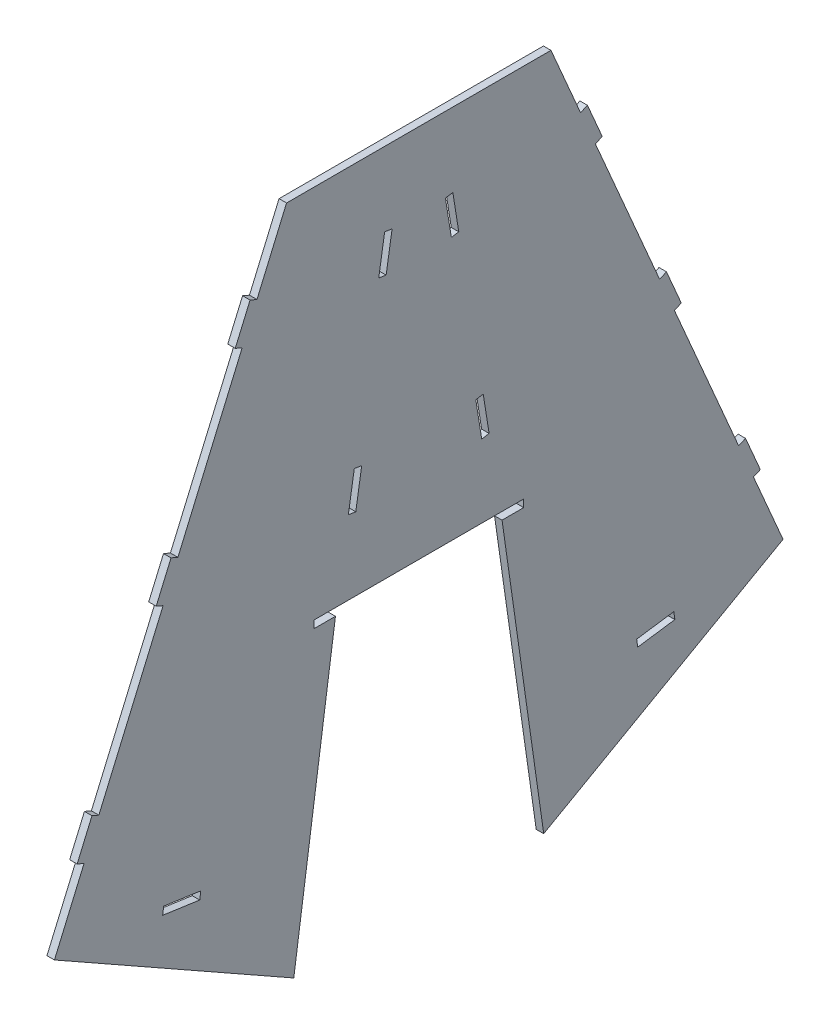
from build123d import *

# Parameters (mm, degrees)
BOSS_EXTRUDE1_DEPTH = 3


with BuildPart() as part:
    # Sketch2 → Boss-Extrude1 (new body)
    with BuildSketch(Plane(origin=(0, 0, 0), x_dir=(0, 0, -1), z_dir=(1, 0, 0))):
        Polygon((0, 0), (-95.762049044, 54.126056228), (-83.922091974, 81.649962502), (-86.677929554, 82.835440985), (-80.750537142, 96.614628885), (-77.994699562, 95.429150402), (-52.294504689, 155.173434164), (-55.050342269, 156.358912646), (-49.122949857, 170.138100547), (-46.367112277, 168.952622064), (-20.666917403, 228.696905826), (-23.422754983, 229.882384308), (-17.495362571, 243.661572208), (-14.739524991, 242.476093726), (-2.899567921, 270), (102.899567921, 270), (114.739524991, 242.476093726), (117.495362571, 243.661572208), (123.422754983, 229.882384308), (120.666917403, 228.696905826), (146.367112277, 168.952622064), (149.122949857, 170.138100547), (155.050342269, 156.358912646), (152.294504689, 155.173434164), (177.994699562, 95.429150402), (180.750537142, 96.614628885), (186.677929554, 82.835440985), (183.922091974, 81.649962502), (195.762049044, 54.126056228), (100, 0), (83.327078723, 117), (92, 117), (92, 120), (80, 120), (20, 120), (8, 120), (8, 117), (16.672921277, 117), align=None)
        Polygon((24.210004629, 164.434828436), (21.840147112, 149.623218958), (24.802469008, 149.149247454), (27.172326524, 163.960856933), align=None, mode=Mode.SUBTRACT)
        Polygon((36.360717046, 240.376781042), (33.990859529, 225.565171564), (36.953181425, 225.09120006), (39.323038941, 239.902809539), align=None, mode=Mode.SUBTRACT)
        Polygon((75.197530992, 149.149247454), (72.827673476, 163.960856933), (75.789995371, 164.434828436), (78.159852888, 149.623218958), align=None, mode=Mode.SUBTRACT)
        Polygon((63.046818575, 225.09120006), (66.009140471, 225.565171564), (63.639282954, 240.376781042), (60.676961059, 239.902809539), align=None, mode=Mode.SUBTRACT)
        Polygon((-52.479172452, 47.958090467), (-37.629195925, 45.841915342), (-37.2059609, 48.811910647), (-52.055937427, 50.928085772), align=None, mode=Mode.SUBTRACT)
        Polygon((137.2059609, 48.811910647), (137.629195925, 45.841915342), (152.479172452, 47.958090467), (152.055937427, 50.928085772), align=None, mode=Mode.SUBTRACT)
    extrude(amount=BOSS_EXTRUDE1_DEPTH)


solid = part.part
